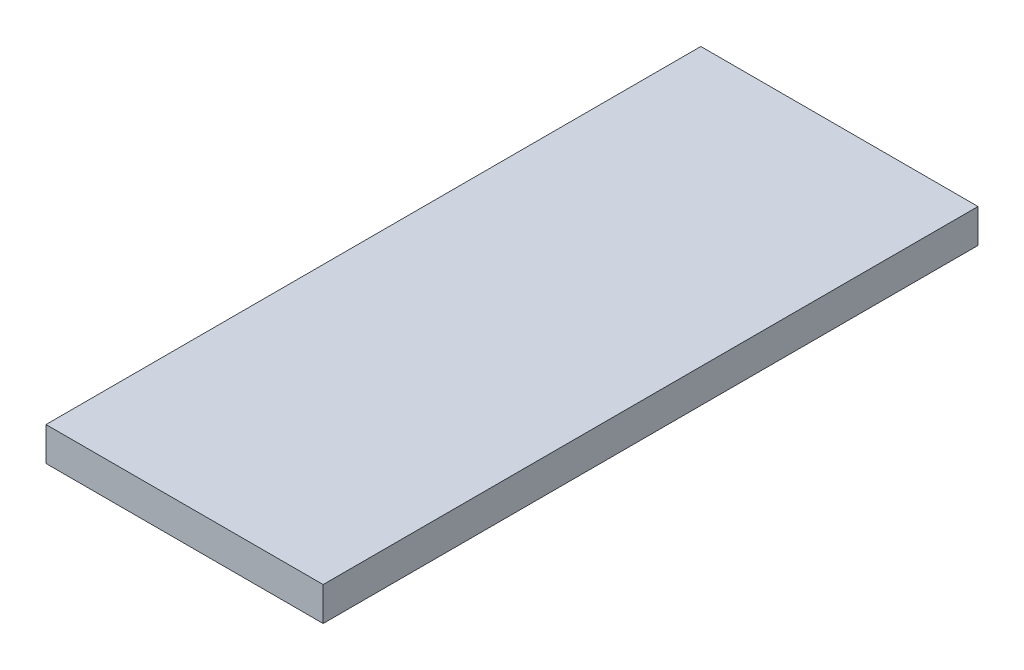
from build123d import *

# Parameters (mm, degrees)
BOSS_EXTRUDE1_START = -2150
SKETCH1_W           = 1820
SKETCH1_H           = 221.701242799
BOSS_EXTRUDE1_DEPTH = 4300


with BuildPart() as part:
    # Sketch1 → Boss-Extrude1 (new body)
    with BuildSketch(Plane.XY.offset(BOSS_EXTRUDE1_START)):
        with Locations((2140, -119.149378601)):
            Rectangle(SKETCH1_W, SKETCH1_H)
    extrude(amount=BOSS_EXTRUDE1_DEPTH)


solid = part.part
